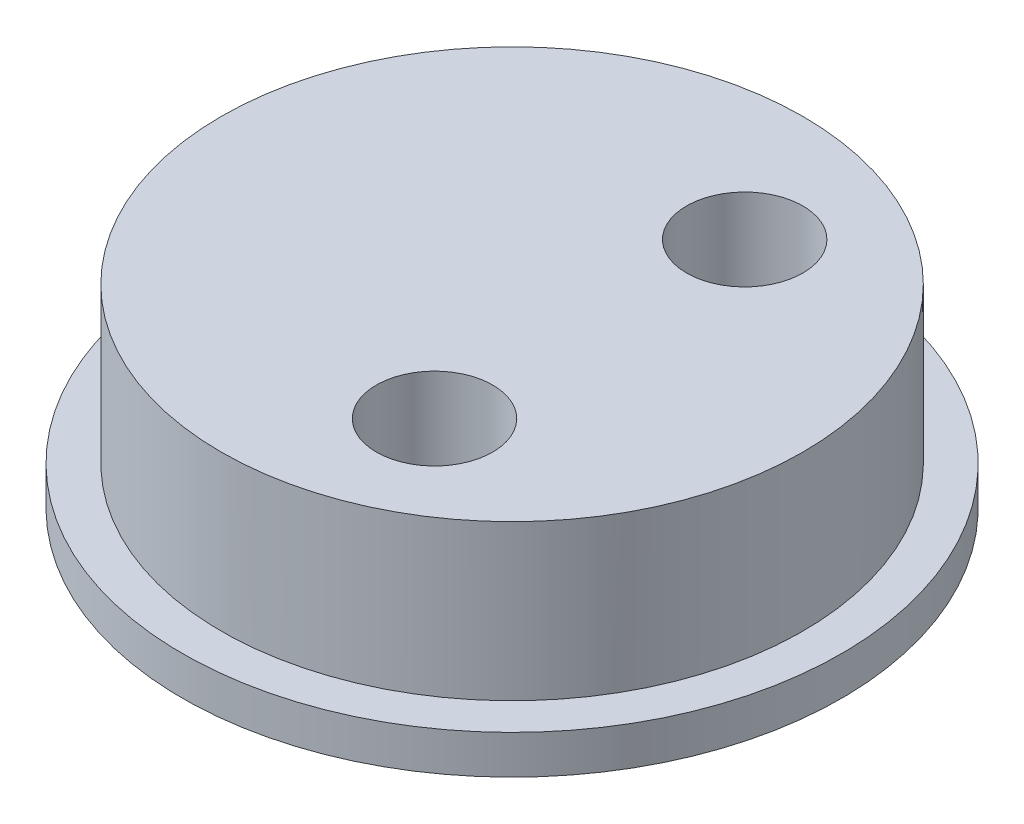
from build123d import *

# Parameters (mm, degrees)
SKETCH1_R           = 7.5
BOSS_EXTRUDE1_DEPTH = 5
SKETCH2_R           = 8.5
BOSS_EXTRUDE2_DEPTH = 1
SKETCH4_R           = 1.5
CUT_EXTRUDE1_DEPTH  = 15.404860291


with BuildPart() as part:
    # Sketch1 → Boss-Extrude1 (new body)
    with BuildSketch(Plane(origin=(0, 0, 0), x_dir=(1, 0, 0), z_dir=(0, 1, 0))):
        with Locations(Location((-2, 0, 0), (0, 0, 270))):
            Circle(SKETCH1_R)
    extrude(amount=BOSS_EXTRUDE1_DEPTH)

    # Sketch2 → Boss-Extrude2 (add)
    with BuildSketch(Plane.XZ):
        with Locations(Location((-2, 0, 0), (0, 0, 270))):
            Circle(SKETCH2_R)
    extrude(amount=-BOSS_EXTRUDE2_DEPTH)

    # Sketch4 → Cut-Extrude1 (cut, through all)
    with BuildSketch(Plane(origin=(0, 5, 0), x_dir=(1, 0, 0), z_dir=(0, 1, 0))):
        with Locations(Location((0, 4, 0), (0, 0, 270))):
            Circle(SKETCH4_R)
        with Locations(Location((0, -4, 0), (0, 0, 270))):
            Circle(SKETCH4_R)
    extrude(amount=-CUT_EXTRUDE1_DEPTH, mode=Mode.SUBTRACT)


solid = part.part
